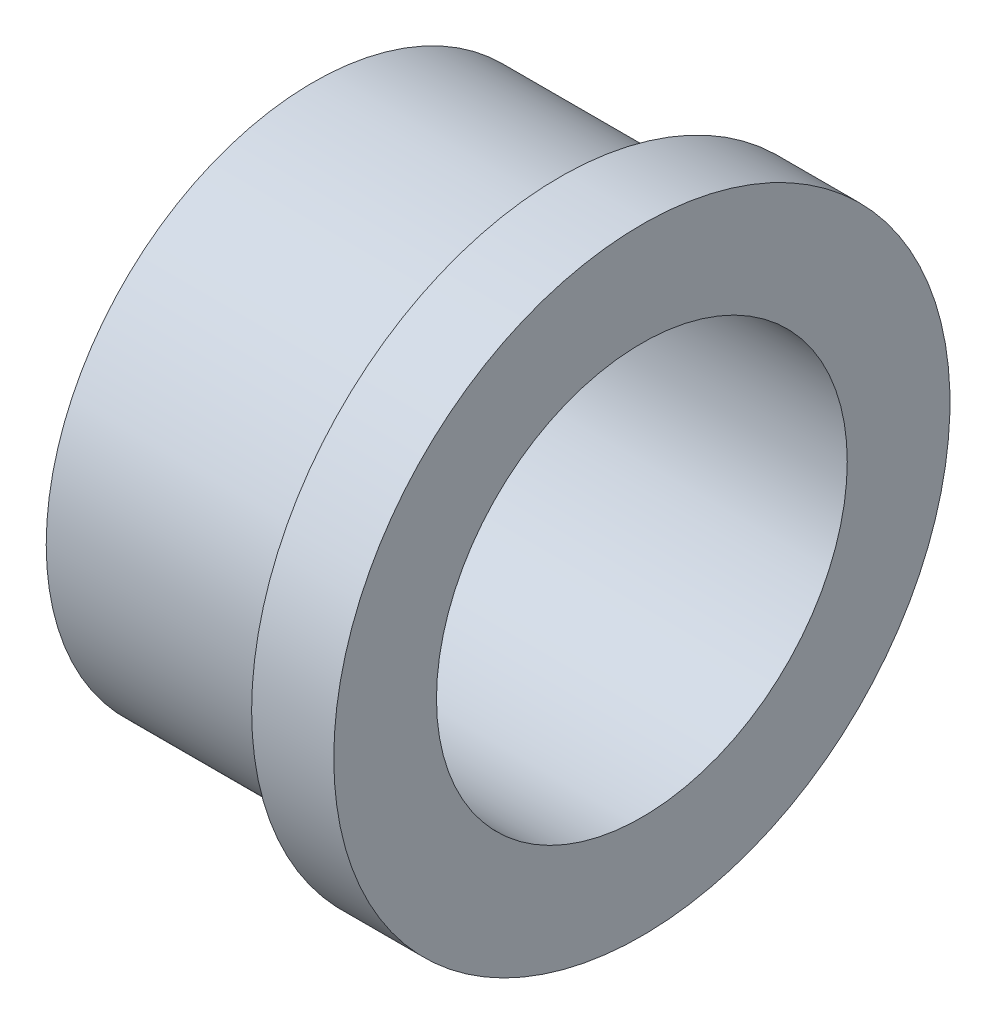
from build123d import *


with BuildPart() as part:
    # 草图1 → 01_GLAND (revolve)
    with BuildSketch(Plane.XY, mode=Mode.PRIVATE) as f_01_gland_sk:
        Polygon((0, 10), (0, 13), (12, 13), (12, 15), (16, 15), (16, 10), align=None)
    revolve(f_01_gland_sk.sketch.rotate(Axis((-5, 0, 0), (1, 0, 0)), 90), axis=Axis((-5, 0, 0), (1, 0, 0)))


solid = part.part
